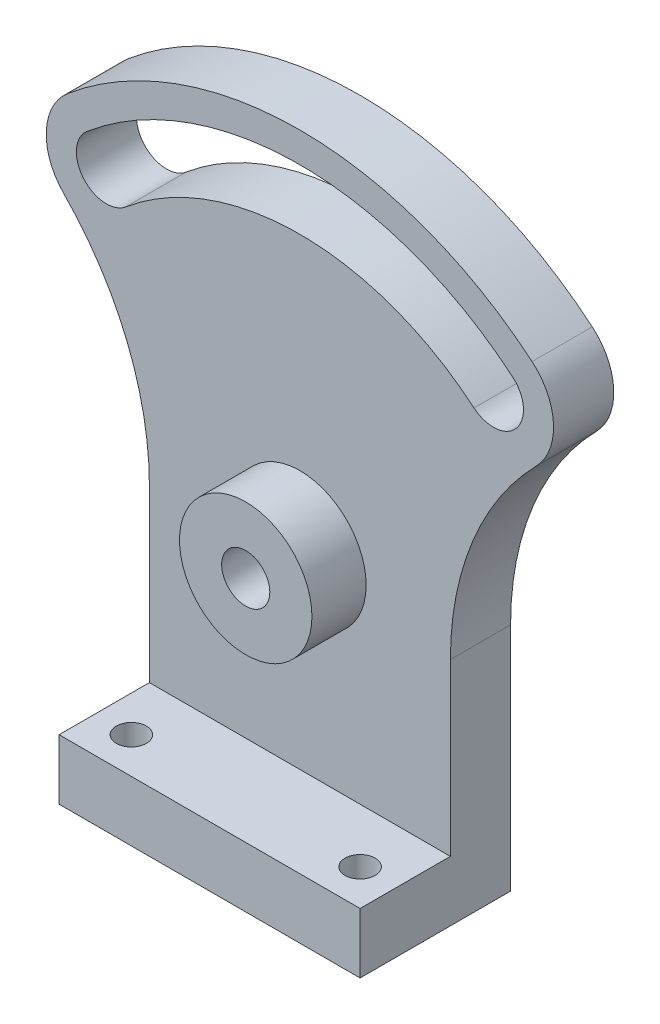
from build123d import *

# Parameters (mm, degrees)
SKETCH1_W             = 50
SKETCH1_H             = 10
BOSS_EXTRUDE1_DEPTH   = 25
SKETCH1_3_R           = 11
SKETCH1_3_R_2         = 4
BOSS_EXTRUDE2_DEPTH   = 10
SKETCH1_5_R           = 11
SKETCH1_5_R_2         = 4
BOSS_EXTRUDE4_DEPTH   = 19
F_5_0MM_DOWEL_HOLE2_D = 5


with BuildPart() as part:
    # Sketch1 → Boss-Extrude1 (new body)
    with BuildSketch(Plane.XY):
        with Locations((0, 5)):
            Rectangle(SKETCH1_W, SKETCH1_H)
    extrude(amount=BOSS_EXTRUDE1_DEPTH)

    # Sketch1<3> → Boss-Extrude2 (add)
    # profile 1 of 3: a face of its own
    with BuildSketch(Plane.XY):
        with BuildLine():
            Line((-25, 38.314518066), (-25, 10))
            Line((-25, 10), (25, 10))
            Line((25, 10), (25, 38.314518066))
            ThreePointArc((25, 38.314518066), (28.70821268, 57.210825292), (39.28281707, 73.304271474))
            ThreePointArc((39.28281707, 73.304271474), (32.626957345, 70.314115789), (25.711504387, 72.641777725))
            ThreePointArc((25.711504387, 72.641777725), (0, 82), (-25.711504387, 72.641777725))
            ThreePointArc((-25.711504387, 72.641777725), (-32.626957345, 70.314115789), (-39.28281707, 73.304271474))
            ThreePointArc((-39.28281707, 73.304271474), (-28.70821268, 57.210825292), (-25, 38.314518066))
        make_face()
        with Locations((0, 42)):
            Circle(SKETCH1_3_R, mode=Mode.SUBTRACT)
    # profile 2 of 3: a face of its own
    with BuildSketch(Plane.XY):
        with Locations((0, 42)):
            Circle(SKETCH1_3_R_2)
    # profile 3 of 3: a face of its own
    with BuildSketch(Plane.XY):
        with BuildLine():
            ThreePointArc((38.567256581, 87.962666587), (0, 102), (-38.567256581, 87.962666587))
            ThreePointArc((-38.567256581, 87.962666587), (-39.799824916, 73.874346059), (-25.711504387, 72.641777725))
            ThreePointArc((-25.711504387, 72.641777725), (0, 82), (25.711504387, 72.641777725))
            ThreePointArc((25.711504387, 72.641777725), (39.799824916, 73.874346059), (38.567256581, 87.962666587))
        make_face()
        with BuildLine():
            ThreePointArc((-35.353318533, 84.132444372), (-35.9696027, 77.088284108), (-28.925442436, 76.47199994))
            ThreePointArc((-28.925442436, 76.47199994), (0, 87), (28.925442436, 76.47199994))
            ThreePointArc((28.925442436, 76.47199994), (35.9696027, 77.088284108), (35.353318533, 84.132444372))
            ThreePointArc((35.353318533, 84.132444372), (0, 97), (-35.353318533, 84.132444372))
        make_face(mode=Mode.SUBTRACT)
    extrude(amount=BOSS_EXTRUDE2_DEPTH)


with BuildPart() as boss_extrude2_piece_1:
    # of the separate pieces the step leaves, piece 1, a body of its own (boss_extrude2_pieces)
    add(part.part.solids().sort_by_distance((-25, 10, 10))[0])



with BuildPart() as boss_extrude2_piece_2:
    # of the separate pieces the step leaves, piece 2, a body of its own (boss_extrude2_pieces)
    add(part.part.solids().sort_by_distance((4, 42, 0))[0])


with BuildPart() as boss_extrude2_piece_1_1:
    add(boss_extrude2_piece_1.part)

    add(boss_extrude2_piece_2.part)  # Boss-Extrude4 merges Boss-Extrude2 piece 2
    # Sketch1<5> → Boss-Extrude4 (add)
    with BuildSketch(Plane.XY):
        with Locations((0, 42)):
            Circle(SKETCH1_5_R)
        with Locations((0, 42)):
            Circle(SKETCH1_5_R_2, mode=Mode.SUBTRACT)
    extrude(amount=BOSS_EXTRUDE4_DEPTH)

    # Ø5.0mm Dowel Hole2 (through all)
    with Locations(Plane(origin=(0, 10, 0), x_dir=(1, 0, 0), z_dir=(0, 1, 0))):
        with Locations((-19, -19), (19, -19)):
            Hole(F_5_0MM_DOWEL_HOLE2_D / 2)


solid = boss_extrude2_piece_1_1.part
